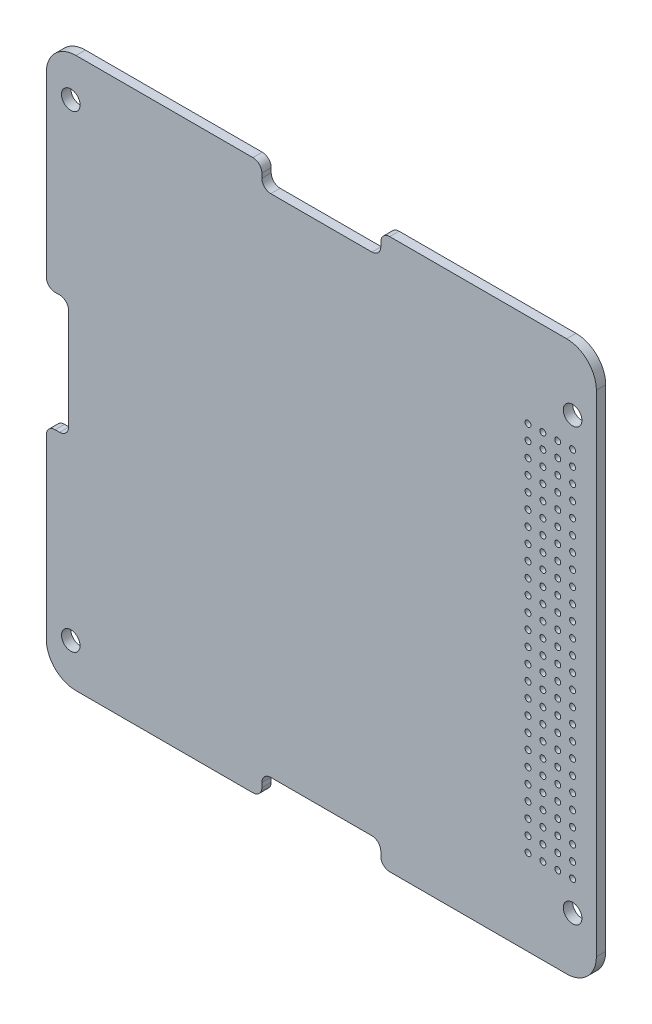
from build123d import *

# Parameters (mm, degrees)
SKETCH1_R           = 1.5875
SKETCH1_R_2         = 0.508
BOSS_EXTRUDE1_DEPTH = 1.6


with BuildPart() as part:
    # Sketch1 → Boss-Extrude1 (new body)
    with BuildSketch(Plane.XY):
        with BuildLine():
            Line((5.08, 0), (35.306, 0))
            ThreePointArc((35.306, 0), (36.383630735, 0.446369265), (36.83, 1.524))
            Line((36.83, 1.524), (36.83, 2.286))
            ThreePointArc((36.83, 2.286), (37.276369265, 3.363630735), (38.354, 3.81))
            Line((38.354, 3.81), (55.626, 3.81))
            ThreePointArc((55.626, 3.81), (56.703630735, 3.363630735), (57.15, 2.286))
            Line((57.15, 2.286), (57.15, 1.524))
            ThreePointArc((57.15, 1.524), (57.596369265, 0.446369265), (58.674, 0))
            Line((58.674, 0), (88.9, 0))
            ThreePointArc((88.9, 0), (92.492102448, 1.487897552), (93.98, 5.08))
            Line((93.98, 5.08), (93.98, 88.9))
            ThreePointArc((93.98, 88.9), (92.492102448, 92.492102448), (88.9, 93.98))
            Line((88.9, 93.98), (58.674, 93.98))
            ThreePointArc((58.674, 93.98), (57.596369265, 93.533630735), (57.15, 92.456))
            Line((57.15, 92.456), (57.15, 91.694))
            ThreePointArc((57.15, 91.694), (56.703630735, 90.616369265), (55.626, 90.17))
            Line((55.626, 90.17), (38.354, 90.17))
            ThreePointArc((38.354, 90.17), (37.276369265, 90.616369265), (36.83, 91.694))
            Line((36.83, 91.694), (36.83, 92.456))
            ThreePointArc((36.83, 92.456), (36.383630735, 93.533630735), (35.306, 93.98))
            Line((35.306, 93.98), (5.08, 93.98))
            ThreePointArc((5.08, 93.98), (1.487897552, 92.492102448), (0, 88.9))
            Line((0, 88.9), (0, 58.674))
            ThreePointArc((0, 58.674), (0.446369265, 57.596369265), (1.524, 57.15))
            Line((1.524, 57.15), (2.286, 57.15))
            ThreePointArc((2.286, 57.15), (3.363630735, 56.703630735), (3.81, 55.626))
            Line((3.81, 55.626), (3.81, 38.354))
            ThreePointArc((3.81, 38.354), (3.363630735, 37.276369265), (2.286, 36.83))
            Line((2.286, 36.83), (1.524, 36.83))
            ThreePointArc((1.524, 36.83), (0.446369265, 36.383630735), (0, 35.306))
            Line((0, 35.306), (0, 5.08))
            ThreePointArc((0, 5.08), (1.487897552, 1.487897552), (5.08, 0))
        make_face()
        with Locations((4.191, 86.995)):
            Circle(SKETCH1_R, mode=Mode.SUBTRACT)
        with Locations((89.916, 83.185)):
            Circle(SKETCH1_R, mode=Mode.SUBTRACT)
        with Locations((89.916, 9.525)):
            Circle(SKETCH1_R, mode=Mode.SUBTRACT)
        with Locations((4.191, 6.985)):
            Circle(SKETCH1_R, mode=Mode.SUBTRACT)
        with Locations((82.296, 78.105)):
            Circle(SKETCH1_R_2, mode=Mode.SUBTRACT)
        with Locations((84.836, 78.105)):
            Circle(SKETCH1_R_2, mode=Mode.SUBTRACT)
        with Locations((87.376, 78.105)):
            Circle(SKETCH1_R_2, mode=Mode.SUBTRACT)
        with Locations((89.916, 78.105)):
            Circle(SKETCH1_R_2, mode=Mode.SUBTRACT)
        with Locations((84.836, 75.565)):
            Circle(SKETCH1_R_2, mode=Mode.SUBTRACT)
        with Locations((87.376, 75.565)):
            Circle(SKETCH1_R_2, mode=Mode.SUBTRACT)
        with Locations((89.916, 75.565)):
            Circle(SKETCH1_R_2, mode=Mode.SUBTRACT)
        with Locations((84.836, 73.025)):
            Circle(SKETCH1_R_2, mode=Mode.SUBTRACT)
        with Locations((87.376, 73.025)):
            Circle(SKETCH1_R_2, mode=Mode.SUBTRACT)
        with Locations((89.916, 73.025)):
            Circle(SKETCH1_R_2, mode=Mode.SUBTRACT)
        with Locations((84.836, 70.485)):
            Circle(SKETCH1_R_2, mode=Mode.SUBTRACT)
        with Locations((87.376, 70.485)):
            Circle(SKETCH1_R_2, mode=Mode.SUBTRACT)
        with Locations((89.916, 70.485)):
            Circle(SKETCH1_R_2, mode=Mode.SUBTRACT)
        with Locations((84.836, 67.945)):
            Circle(SKETCH1_R_2, mode=Mode.SUBTRACT)
        with Locations((87.376, 67.945)):
            Circle(SKETCH1_R_2, mode=Mode.SUBTRACT)
        with Locations((89.916, 67.945)):
            Circle(SKETCH1_R_2, mode=Mode.SUBTRACT)
        with Locations((84.836, 65.405)):
            Circle(SKETCH1_R_2, mode=Mode.SUBTRACT)
        with Locations((87.376, 65.405)):
            Circle(SKETCH1_R_2, mode=Mode.SUBTRACT)
        with Locations((89.916, 65.405)):
            Circle(SKETCH1_R_2, mode=Mode.SUBTRACT)
        with Locations((84.836, 62.865)):
            Circle(SKETCH1_R_2, mode=Mode.SUBTRACT)
        with Locations((87.376, 62.865)):
            Circle(SKETCH1_R_2, mode=Mode.SUBTRACT)
        with Locations((89.916, 62.865)):
            Circle(SKETCH1_R_2, mode=Mode.SUBTRACT)
        with Locations((84.836, 60.325)):
            Circle(SKETCH1_R_2, mode=Mode.SUBTRACT)
        with Locations((87.376, 60.325)):
            Circle(SKETCH1_R_2, mode=Mode.SUBTRACT)
        with Locations((89.916, 60.325)):
            Circle(SKETCH1_R_2, mode=Mode.SUBTRACT)
        with Locations((84.836, 57.785)):
            Circle(SKETCH1_R_2, mode=Mode.SUBTRACT)
        with Locations((87.376, 57.785)):
            Circle(SKETCH1_R_2, mode=Mode.SUBTRACT)
        with Locations((89.916, 57.785)):
            Circle(SKETCH1_R_2, mode=Mode.SUBTRACT)
        with Locations((84.836, 55.245)):
            Circle(SKETCH1_R_2, mode=Mode.SUBTRACT)
        with Locations((87.376, 55.245)):
            Circle(SKETCH1_R_2, mode=Mode.SUBTRACT)
        with Locations((89.916, 55.245)):
            Circle(SKETCH1_R_2, mode=Mode.SUBTRACT)
        with Locations((84.836, 52.705)):
            Circle(SKETCH1_R_2, mode=Mode.SUBTRACT)
        with Locations((87.376, 52.705)):
            Circle(SKETCH1_R_2, mode=Mode.SUBTRACT)
        with Locations((89.916, 52.705)):
            Circle(SKETCH1_R_2, mode=Mode.SUBTRACT)
        with Locations((84.836, 50.165)):
            Circle(SKETCH1_R_2, mode=Mode.SUBTRACT)
        with Locations((87.376, 50.165)):
            Circle(SKETCH1_R_2, mode=Mode.SUBTRACT)
        with Locations((89.916, 50.165)):
            Circle(SKETCH1_R_2, mode=Mode.SUBTRACT)
        with Locations((84.836, 47.625)):
            Circle(SKETCH1_R_2, mode=Mode.SUBTRACT)
        with Locations((87.376, 47.625)):
            Circle(SKETCH1_R_2, mode=Mode.SUBTRACT)
        with Locations((89.916, 47.625)):
            Circle(SKETCH1_R_2, mode=Mode.SUBTRACT)
        with Locations((84.836, 45.085)):
            Circle(SKETCH1_R_2, mode=Mode.SUBTRACT)
        with Locations((87.376, 45.085)):
            Circle(SKETCH1_R_2, mode=Mode.SUBTRACT)
        with Locations((89.916, 45.085)):
            Circle(SKETCH1_R_2, mode=Mode.SUBTRACT)
        with Locations((84.836, 42.545)):
            Circle(SKETCH1_R_2, mode=Mode.SUBTRACT)
        with Locations((87.376, 42.545)):
            Circle(SKETCH1_R_2, mode=Mode.SUBTRACT)
        with Locations((89.916, 42.545)):
            Circle(SKETCH1_R_2, mode=Mode.SUBTRACT)
        with Locations((84.836, 40.005)):
            Circle(SKETCH1_R_2, mode=Mode.SUBTRACT)
        with Locations((87.376, 40.005)):
            Circle(SKETCH1_R_2, mode=Mode.SUBTRACT)
        with Locations((89.916, 40.005)):
            Circle(SKETCH1_R_2, mode=Mode.SUBTRACT)
        with Locations((84.836, 37.465)):
            Circle(SKETCH1_R_2, mode=Mode.SUBTRACT)
        with Locations((87.376, 37.465)):
            Circle(SKETCH1_R_2, mode=Mode.SUBTRACT)
        with Locations((89.916, 37.465)):
            Circle(SKETCH1_R_2, mode=Mode.SUBTRACT)
        with Locations((84.836, 34.925)):
            Circle(SKETCH1_R_2, mode=Mode.SUBTRACT)
        with Locations((87.376, 34.925)):
            Circle(SKETCH1_R_2, mode=Mode.SUBTRACT)
        with Locations((89.916, 34.925)):
            Circle(SKETCH1_R_2, mode=Mode.SUBTRACT)
        with Locations((84.836, 32.385)):
            Circle(SKETCH1_R_2, mode=Mode.SUBTRACT)
        with Locations((87.376, 32.385)):
            Circle(SKETCH1_R_2, mode=Mode.SUBTRACT)
        with Locations((89.916, 32.385)):
            Circle(SKETCH1_R_2, mode=Mode.SUBTRACT)
        with Locations((84.836, 29.845)):
            Circle(SKETCH1_R_2, mode=Mode.SUBTRACT)
        with Locations((87.376, 29.845)):
            Circle(SKETCH1_R_2, mode=Mode.SUBTRACT)
        with Locations((89.916, 29.845)):
            Circle(SKETCH1_R_2, mode=Mode.SUBTRACT)
        with Locations((84.836, 27.305)):
            Circle(SKETCH1_R_2, mode=Mode.SUBTRACT)
        with Locations((87.376, 27.305)):
            Circle(SKETCH1_R_2, mode=Mode.SUBTRACT)
        with Locations((89.916, 27.305)):
            Circle(SKETCH1_R_2, mode=Mode.SUBTRACT)
        with Locations((84.836, 24.765)):
            Circle(SKETCH1_R_2, mode=Mode.SUBTRACT)
        with Locations((87.376, 24.765)):
            Circle(SKETCH1_R_2, mode=Mode.SUBTRACT)
        with Locations((89.916, 24.765)):
            Circle(SKETCH1_R_2, mode=Mode.SUBTRACT)
        with Locations((84.836, 22.225)):
            Circle(SKETCH1_R_2, mode=Mode.SUBTRACT)
        with Locations((87.376, 22.225)):
            Circle(SKETCH1_R_2, mode=Mode.SUBTRACT)
        with Locations((89.916, 22.225)):
            Circle(SKETCH1_R_2, mode=Mode.SUBTRACT)
        with Locations((84.836, 19.685)):
            Circle(SKETCH1_R_2, mode=Mode.SUBTRACT)
        with Locations((87.376, 19.685)):
            Circle(SKETCH1_R_2, mode=Mode.SUBTRACT)
        with Locations((89.916, 19.685)):
            Circle(SKETCH1_R_2, mode=Mode.SUBTRACT)
        with Locations((84.836, 17.145)):
            Circle(SKETCH1_R_2, mode=Mode.SUBTRACT)
        with Locations((87.376, 17.145)):
            Circle(SKETCH1_R_2, mode=Mode.SUBTRACT)
        with Locations((89.916, 17.145)):
            Circle(SKETCH1_R_2, mode=Mode.SUBTRACT)
        with Locations((84.836, 14.605)):
            Circle(SKETCH1_R_2, mode=Mode.SUBTRACT)
        with Locations((87.376, 14.605)):
            Circle(SKETCH1_R_2, mode=Mode.SUBTRACT)
        with Locations((89.916, 14.605)):
            Circle(SKETCH1_R_2, mode=Mode.SUBTRACT)
        with Locations((82.296, 75.565)):
            Circle(SKETCH1_R_2, mode=Mode.SUBTRACT)
        with Locations((82.296, 73.025)):
            Circle(SKETCH1_R_2, mode=Mode.SUBTRACT)
        with Locations((82.296, 70.485)):
            Circle(SKETCH1_R_2, mode=Mode.SUBTRACT)
        with Locations((82.296, 67.945)):
            Circle(SKETCH1_R_2, mode=Mode.SUBTRACT)
        with Locations((82.296, 65.405)):
            Circle(SKETCH1_R_2, mode=Mode.SUBTRACT)
        with Locations((82.296, 62.865)):
            Circle(SKETCH1_R_2, mode=Mode.SUBTRACT)
        with Locations((82.296, 60.325)):
            Circle(SKETCH1_R_2, mode=Mode.SUBTRACT)
        with Locations((82.296, 57.785)):
            Circle(SKETCH1_R_2, mode=Mode.SUBTRACT)
        with Locations((82.296, 55.245)):
            Circle(SKETCH1_R_2, mode=Mode.SUBTRACT)
        with Locations((82.296, 52.705)):
            Circle(SKETCH1_R_2, mode=Mode.SUBTRACT)
        with Locations((82.296, 50.165)):
            Circle(SKETCH1_R_2, mode=Mode.SUBTRACT)
        with Locations((82.296, 47.625)):
            Circle(SKETCH1_R_2, mode=Mode.SUBTRACT)
        with Locations((82.296, 45.085)):
            Circle(SKETCH1_R_2, mode=Mode.SUBTRACT)
        with Locations((82.296, 42.545)):
            Circle(SKETCH1_R_2, mode=Mode.SUBTRACT)
        with Locations((82.296, 40.005)):
            Circle(SKETCH1_R_2, mode=Mode.SUBTRACT)
        with Locations((82.296, 37.465)):
            Circle(SKETCH1_R_2, mode=Mode.SUBTRACT)
        with Locations((82.296, 34.925)):
            Circle(SKETCH1_R_2, mode=Mode.SUBTRACT)
        with Locations((82.296, 32.385)):
            Circle(SKETCH1_R_2, mode=Mode.SUBTRACT)
        with Locations((82.296, 29.845)):
            Circle(SKETCH1_R_2, mode=Mode.SUBTRACT)
        with Locations((82.296, 27.305)):
            Circle(SKETCH1_R_2, mode=Mode.SUBTRACT)
        with Locations((82.296, 24.765)):
            Circle(SKETCH1_R_2, mode=Mode.SUBTRACT)
        with Locations((82.296, 22.225)):
            Circle(SKETCH1_R_2, mode=Mode.SUBTRACT)
        with Locations((82.296, 19.685)):
            Circle(SKETCH1_R_2, mode=Mode.SUBTRACT)
        with Locations((82.296, 17.145)):
            Circle(SKETCH1_R_2, mode=Mode.SUBTRACT)
        with Locations((82.296, 14.605)):
            Circle(SKETCH1_R_2, mode=Mode.SUBTRACT)
    extrude(amount=BOSS_EXTRUDE1_DEPTH)


solid = part.part
